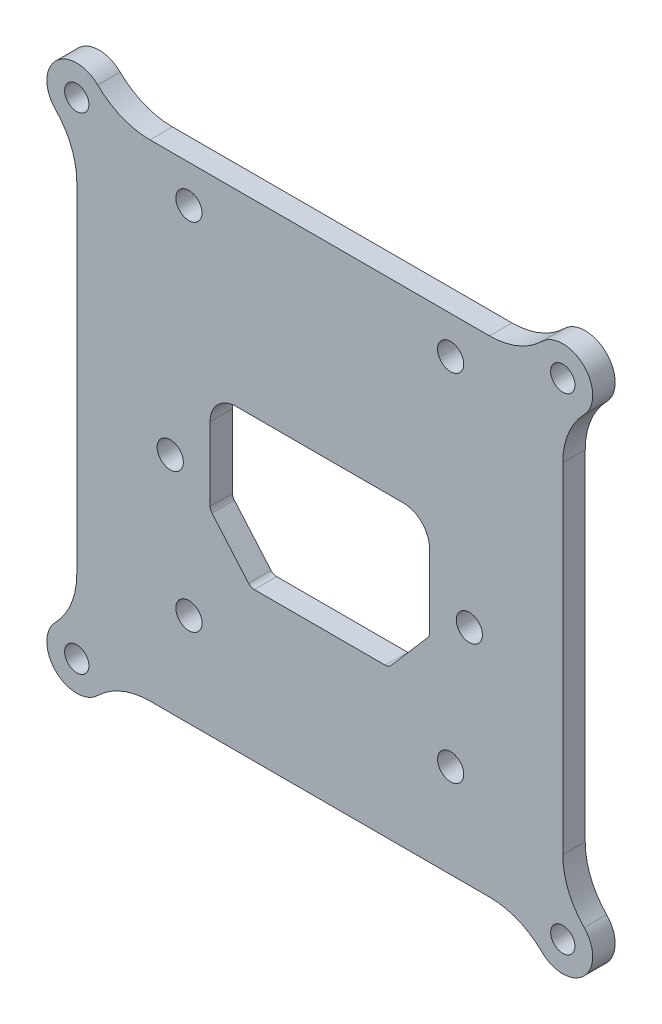
from build123d import *

# Parameters (mm, degrees)
SKETCH_1_R          = 1.625
EXTRUDE_1_DEPTH     = 3
FILLET_1_R          = 10
SKETCH_3_R          = 1.75
CUT_EXTRUDE_1_DEPTH = 10
SKETCH_4_R          = 1.75
CUT_EXTRUDE_2_DEPTH = 10
SKETCH_5_R          = 1.75
CUT_EXTRUDE_3_DEPTH = 10
CUT_EXTRUDE_5_DEPTH = 10


with BuildPart() as part:
    # Эскиз1 → Бобышка-Вытянуть1 (new body)
    with BuildSketch(Plane.XY):
        with BuildLine():
            ThreePointArc((-32.5, -28.5), (-35.328427125, -35.328427125), (-28.5, -32.5))
            Line((-28.5, -32.5), (28.5, -32.5))
            ThreePointArc((28.5, -32.5), (35.328427125, -35.328427125), (32.5, -28.5))
            Line((32.5, -28.5), (32.5, 28.5))
            ThreePointArc((32.5, 28.5), (35.328427125, 35.328427125), (28.5, 32.5))
            Line((28.5, 32.5), (-28.5, 32.5))
            ThreePointArc((-28.5, 32.5), (-35.328427125, 35.328427125), (-32.5, 28.5))
            Line((-32.5, 28.5), (-32.5, -28.5))
        make_face()
        with Locations((-32.5, -32.5)):
            Circle(SKETCH_1_R, mode=Mode.SUBTRACT)
        with Locations((32.5, 32.5)):
            Circle(SKETCH_1_R, mode=Mode.SUBTRACT)
        with Locations((-32.5, 32.5)):
            Circle(SKETCH_1_R, mode=Mode.SUBTRACT)
        with Locations((32.5, -32.5)):
            Circle(SKETCH_1_R, mode=Mode.SUBTRACT)
    extrude(amount=EXTRUDE_1_DEPTH)

    # Скругление1
    fillet_1_edges = [part.edges().sort_by_distance(p)[0] for p in [
        (-32.5, -28.5, 1.5),
        (-32.5, 28.5, 1.5),
        (-28.5, 32.5, 1.5),
        (28.5, 32.5, 1.5),
        (32.5, 28.5, 1.5),
        (32.5, -28.5, 1.5),
        (28.5, -32.5, 1.5),
        (-28.5, -32.5, 1.5),
    ]]
    fillet(fillet_1_edges, radius=FILLET_1_R)

    # Эскиз3 → Вырез-Вытянуть1 (cut)
    with BuildSketch(Plane(origin=(0, 0, 0), x_dir=(-1, 0, 0), z_dir=(0, 0, -1))):
        with Locations((-17.5, 27.5)):
            Circle(SKETCH_3_R)
        with Locations(Location((17.5, 27.5, 0), (0, 0, 180))):
            Circle(SKETCH_3_R)
    extrude(amount=-CUT_EXTRUDE_1_DEPTH, mode=Mode.SUBTRACT)

    # Эскиз4 → Вырез-Вытянуть2 (cut)
    with BuildSketch(Plane(origin=(0, 0, 0), x_dir=(-1, 0, 0), z_dir=(0, 0, -1))):
        with Locations((-20, -2.615263412)):
            Circle(SKETCH_4_R)
        with Locations(Location((20, -2.615263412, 0), (0, 0, 180))):
            Circle(SKETCH_4_R)
    extrude(amount=-CUT_EXTRUDE_2_DEPTH, mode=Mode.SUBTRACT)

    # Эскиз5 → Вырез-Вытянуть3 (cut)
    with BuildSketch(Plane.XY.offset(3)):
        with Locations((-17.5, -20)):
            Circle(SKETCH_5_R)
        with Locations((17.5, -20)):
            Circle(SKETCH_5_R)
    extrude(amount=-CUT_EXTRUDE_3_DEPTH, mode=Mode.SUBTRACT)

    # Эскиз6 → Вырез-Вытянуть5 (cut)
    with BuildSketch(Plane.XY.offset(3)):
        with BuildLine():
            ThreePointArc((-14.17, 3.884736588), (-13.825652378, 5.280268906), (-12.871659701, 6.355435733))
            Line((-12.871659701, 6.355435733), (-14.131289938, 5.750416599))
            ThreePointArc((-14.131289938, 5.750416599), (-14.532626561, 4.855685922), (-14.67, 3.884736588))
            Line((-14.67, 3.884736588), (-14.67, -5.929561494))
            ThreePointArc((-14.67, -5.929561494), (-14.607432841, -6.277727646), (-14.427560661, -6.582326264))
            Line((-14.427560661, -6.582326264), (-9.528380842, -12.268028181))
            ThreePointArc((-9.528380842, -12.268028181), (-9.187494653, -12.524319177), (-8.770820181, -12.615263412))
            Line((-8.770820181, -12.615263412), (8.770820181, -12.615263412))
            ThreePointArc((8.770820181, -12.615263412), (9.187494653, -12.524319177), (9.528380842, -12.268028181))
            Line((9.528380842, -12.268028181), (14.427560661, -6.582326264))
            ThreePointArc((14.427560661, -6.582326264), (14.607432841, -6.277727646), (14.67, -5.929561494))
            Line((14.67, -5.929561494), (14.67, 3.884736588))
            ThreePointArc((14.67, 3.884736588), (14.532626561, 4.855685922), (14.131289938, 5.750416599))
            Line((14.131289938, 5.750416599), (12.871659701, 6.355435733))
            ThreePointArc((12.871659701, 6.355435733), (13.825652378, 5.280268906), (14.17, 3.884736588))
            Line((14.17, 3.884736588), (14.17, -5.929561494))
            ThreePointArc((14.17, -5.929561494), (14.13871642, -6.10364457), (14.048780331, -6.255943879))
            Line((14.048780331, -6.255943879), (9.149600512, -11.941645796))
            ThreePointArc((9.149600512, -11.941645796), (8.979157417, -12.069791294), (8.770820181, -12.115263412))
            Line((8.770820181, -12.115263412), (-8.770820181, -12.115263412))
            ThreePointArc((-8.770820181, -12.115263412), (-8.979157417, -12.069791294), (-9.149600512, -11.941645796))
            Line((-9.149600512, -11.941645796), (-14.048780331, -6.255943879))
            ThreePointArc((-14.048780331, -6.255943879), (-14.13871642, -6.10364457), (-14.17, -5.929561494))
            Line((-14.17, -5.929561494), (-14.17, 3.884736588))
        make_face()
        with BuildLine():
            Line((11.17, 7.384736588), (10.728688662, 7.384736588))
            Line((10.728688662, 7.384736588), (12.034826728, 6.757379053))
            ThreePointArc((12.034826728, 6.757379053), (12.468885198, 6.588973494), (12.871659701, 6.355435733))
            Line((12.871659701, 6.355435733), (14.131289938, 5.750416599))
            ThreePointArc((14.131289938, 5.750416599), (13.694992017, 6.308455903), (13.155269651, 6.767218923))
            add(Edge.make_bspline(
                [(12.178964517, 7.236152797), (12.708169697, 7.084996084), (13.155269651, 6.767218923)],
                knots=[0, 0, 0, 1, 1, 1], degree=2))
            ThreePointArc((12.178964517, 7.236152797), (11.679923165, 7.347391403), (11.17, 7.384736588))
        make_face()
        with BuildLine():
            Line((-10.728688662, 7.384736588), (-12.034826728, 6.757379053))
            ThreePointArc((-12.034826728, 6.757379053), (-11.607076999, 6.85272643), (-11.17, 6.884736588))
            Line((-11.17, 6.884736588), (11.17, 6.884736588))
            ThreePointArc((11.17, 6.884736588), (11.607076999, 6.85272643), (12.034826728, 6.757379053))
            Line((12.034826728, 6.757379053), (10.728688662, 7.384736588))
            Line((10.728688662, 7.384736588), (-10.728688662, 7.384736588))
        make_face()
        with BuildLine():
            Line((-14.131289938, 5.750416599), (-12.871659701, 6.355435733))
            ThreePointArc((-12.871659701, 6.355435733), (-12.468885198, 6.588973494), (-12.034826728, 6.757379053))
            Line((-12.034826728, 6.757379053), (-10.728688662, 7.384736588))
            Line((-10.728688662, 7.384736588), (-11.17, 7.384736588))
            ThreePointArc((-11.17, 7.384736588), (-11.679923165, 7.347391403), (-12.178964517, 7.236152797))
            add(Edge.make_bspline(
                [(-12.178964517, 7.236152797), (-12.706483, 7.080112966), (-13.155269651, 6.767218923)],
                knots=[0, 0, 0, 1, 1, 1], degree=2))
            ThreePointArc((-13.155269651, 6.767218923), (-13.694992017, 6.308455903), (-14.131289938, 5.750416599))
        make_face()
    extrude(amount=-CUT_EXTRUDE_5_DEPTH, mode=Mode.SUBTRACT)


with BuildPart() as body_2:
    # of the pieces the cut leaves, the one that is kept (cut_extrude_5_keep)
    add(part.part.solids().sort_by_distance((-32.5, 22.702041029, 0))[0])


solid = body_2.part
